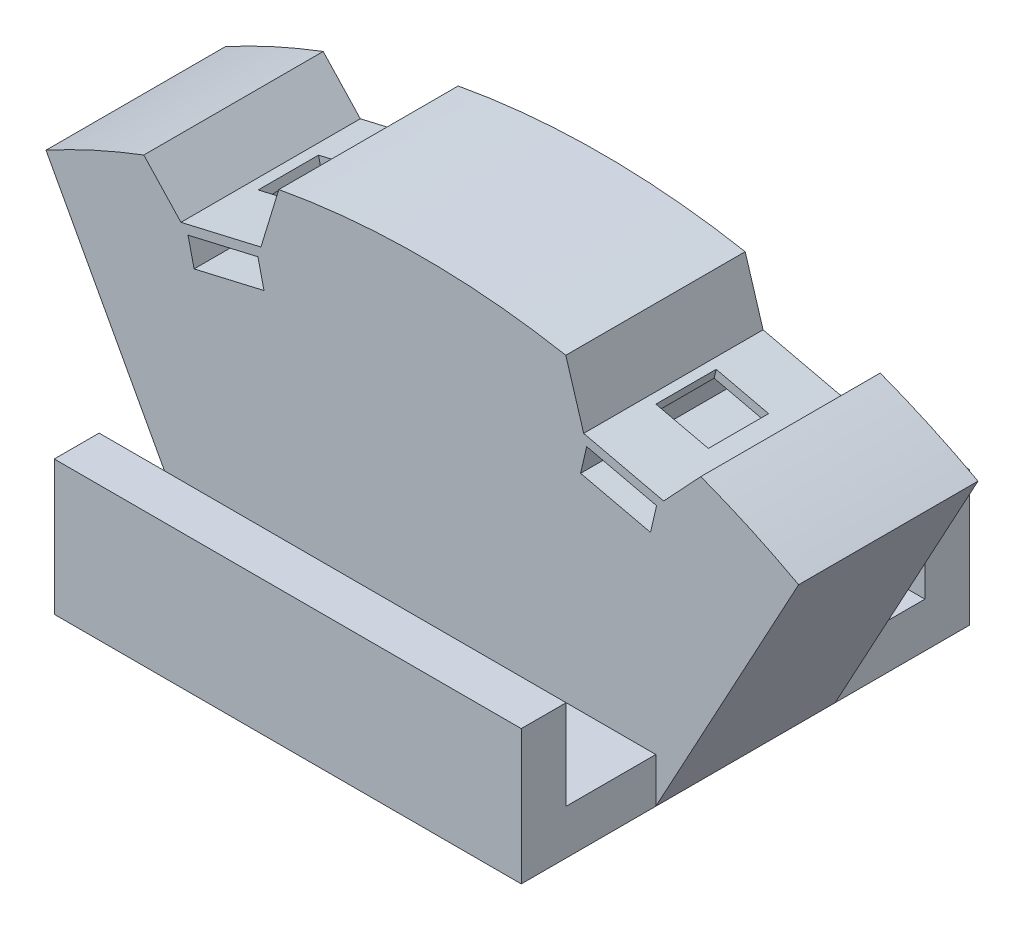
from build123d import *

# Parameters (mm, degrees)
EXTRUSION1_DEPTH = 12.7
SKETCH2_R        = 0.0001
EXTRUSION2_DEPTH = 12.7
EXTRUSION3_REACH = 47.242
SKETCH3_W        = 3.81
SKETCH3_H        = 4.269275936
EXTRUSION4_REACH = 47.242
SKETCH4_W        = 3.81
SKETCH4_H        = 4.2672
SKETCH5_W        = 33.063140678
SKETCH5_H        = 3.175
EXTRUSION5_DEPTH = 9.525
SKETCH6_W        = 33.063140678
SKETCH6_H        = 3.175
EXTRUSION6_DEPTH = 6.35
SKETCH7_W        = 33.063140678
SKETCH7_H        = 3.175
EXTRUSION7_DEPTH = 9.525
SKETCH8_W        = 33.063140678
SKETCH8_H        = 3.175
EXTRUSION8_DEPTH = 6.35


with BuildPart() as part:
    # Sketch1 → Extrusion1 (new body)
    with BuildSketch(Plane.XY):
        with BuildLine():
            Line((-46.835285843, 30.48), (46.835285843, 30.48))
            ThreePointArc((46.835285843, 30.48), (26.639744744, 49.121262199), (0, 55.88))
            ThreePointArc((0, 55.88), (-26.639744744, 49.121262199), (-46.835285843, 30.48))
        make_face()
    extrude(amount=-EXTRUSION1_DEPTH)

    # Sketch2 → Extrusion2 (cut)
    with BuildSketch(Plane.XY):
        Polygon((-17.087387335, 49.474285222), (-11.424998154, 50.789978227), (-10.16, 54.948601438), (-13.629796213, 58.658980697), (-18.577977015, 57.50923866), (-20.056361604, 52.649117364), align=None)
        Polygon((18.577977015, 57.50923866), (13.629796213, 58.658980697), (10.16, 54.948601438), (11.424998154, 50.789978227), (17.087387335, 49.474285222), (20.056361604, 52.649117364), align=None)
        with Locations((-0.000275836, 0.000298823)):
            Circle(SKETCH2_R)
        with BuildLine():
            Line((-46.835285843, 30.48), (-0.000330381, 0.000215009))
            Line((-0.000330381, 0.000215009), (-26.641574626, 49.120269761))
            ThreePointArc((-26.641574626, 49.120269761), (-37.902205349, 41.060896601), (-46.835285843, 30.48))
        make_face()
        with Locations((0.000275836, 0.000298823)):
            Circle(SKETCH2_R)
        with BuildLine():
            Line((26.641574627, 49.120269761), (0.000187932, 0.0003465))
            Line((0.000187932, 0.0003465), (46.835285843, 30.48))
            ThreePointArc((46.835285843, 30.48), (37.902205349, 41.060896601), (26.641574627, 49.120269761))
        make_face()
        Polygon((11.207321789, 48.233301672), (16.155502591, 47.083559635), (16.586565391, 48.938738106), (11.638384589, 50.088480143), align=None)
        Polygon((-16.155412127, 47.083170305), (-11.207231325, 48.232912342), (-11.638384589, 50.088480143), (-16.586565391, 48.938738106), align=None)
    extrude(amount=-EXTRUSION2_DEPTH, mode=Mode.SUBTRACT)

    # Sketch3 → Extrusion3 (cut, up to next)
    with BuildSketch(Plane(origin=(-11.782102344, 50.707002743, 0), x_dir=(-0.9740513389582227, -0.22632717263663577, 0), z_dir=(-0.22632717263663577, 0.9740513389582227, 0)), mode=Mode.PRIVATE) as extrusion3_sk1:
        with Locations((2.54, -6.628362032)):
            Rectangle(SKETCH3_W, SKETCH3_H)
    extrusion3_tool1 = extrude(extrusion3_sk1.sketch, amount=-EXTRUSION3_REACH, mode=Mode.PRIVATE) & part.part
    add(extrusion3_tool1.solids().sort_by_distance((-14.256193, 50.132132, -6.628362))[0], mode=Mode.SUBTRACT)

    # Sketch4 → Extrusion4 (cut, up to next)
    with BuildSketch(Plane(origin=(11.782102344, 50.707002743, 0), x_dir=(-0.974051338958225, 0.22632717263662588, 0), z_dir=(0.2263271726366259, 0.9740513389582252, 0)), mode=Mode.PRIVATE) as extrusion4_sk1:
        with Locations((-2.173382579, -6.6294)):
            Rectangle(SKETCH4_W, SKETCH4_H)
    extrusion4_tool1 = extrude(extrusion4_sk1.sketch, amount=-EXTRUSION4_REACH, mode=Mode.PRIVATE) & part.part
    add(extrusion4_tool1.solids().sort_by_distance((13.899089, 50.215107, -6.6294))[0], mode=Mode.SUBTRACT)

    # Sketch5 → Extrusion5 (add)
    with BuildSketch(Plane(origin=(0, 0, -12.7), x_dir=(-1, 0, 0), z_dir=(0, 0, -1))):
        with Locations((0, 32.0675)):
            Rectangle(SKETCH5_W, SKETCH5_H)
    extrude(amount=EXTRUSION5_DEPTH)

    # Sketch6 → Extrusion6 (add)
    with BuildSketch(Plane(origin=(0, 33.655, 0), x_dir=(-1, 0, 0), z_dir=(0, 1, 0))):
        with Locations((0, -20.6375)):
            Rectangle(SKETCH6_W, SKETCH6_H)
    extrude(amount=EXTRUSION6_DEPTH)

    # Sketch7 → Extrusion7 (add)
    with BuildSketch(Plane.XY):
        with Locations((0, 32.0675)):
            Rectangle(SKETCH7_W, SKETCH7_H)
    extrude(amount=EXTRUSION7_DEPTH)

    # Sketch8 → Extrusion8 (add)
    with BuildSketch(Plane(origin=(0, 33.655, 0), x_dir=(-1, 0, 0), z_dir=(0, 1, 0))):
        with Locations((0, 7.9375)):
            Rectangle(SKETCH8_W, SKETCH8_H)
    extrude(amount=EXTRUSION8_DEPTH)


solid = part.part
